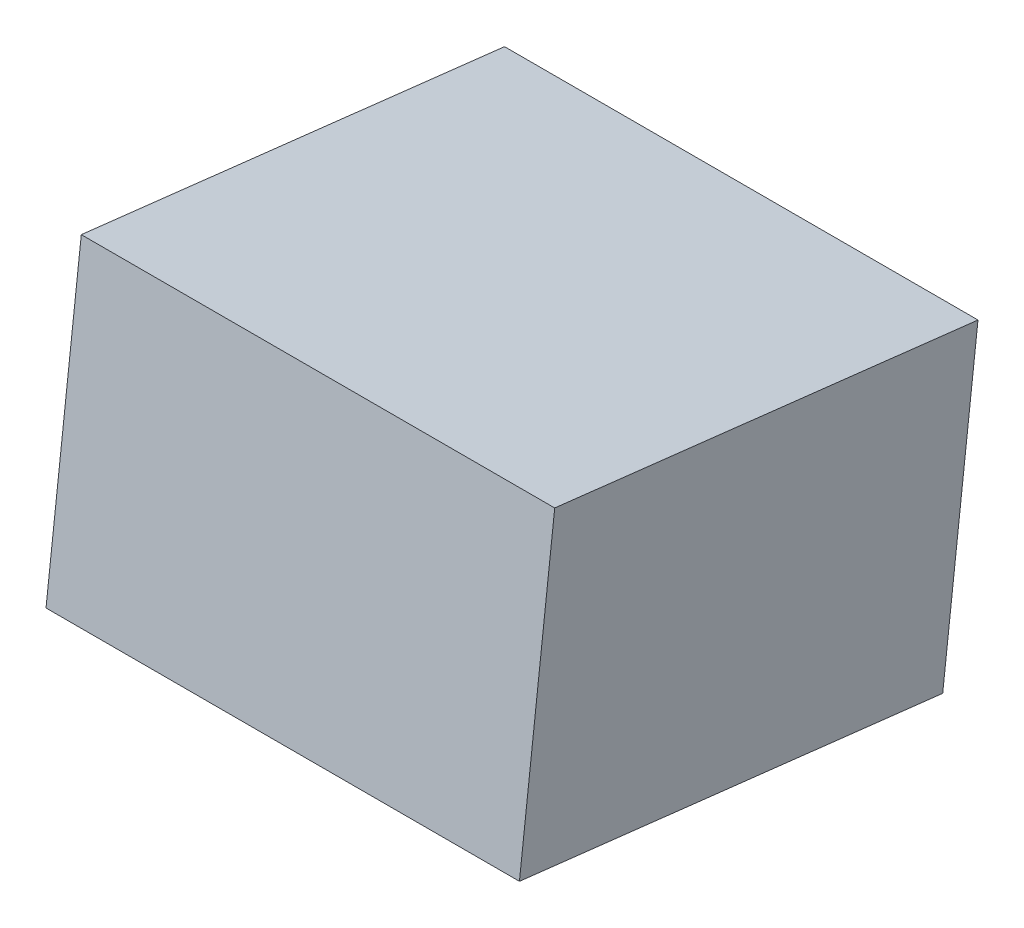
from build123d import *

# Parameters (mm, degrees)
SKETCH1_W           = 200
SKETCH1_H           = 180
BOSS_EXTRUDE1_DEPTH = 130


with BuildPart() as part:
    # Sketch1 → Boss-Extrude1 (new body)
    with BuildSketch(Plane(origin=(0, 358.879876801, -41.422455829), x_dir=(1, 0, 0), z_dir=(-6.837425950214788e-15, 0.9934047622419533, -0.1146602736566085))):
        with Locations((-131.67305734, 193.10655766)):
            Rectangle(SKETCH1_W, SKETCH1_H)
    extrude(amount=BOSS_EXTRUDE1_DEPTH)


solid = part.part
